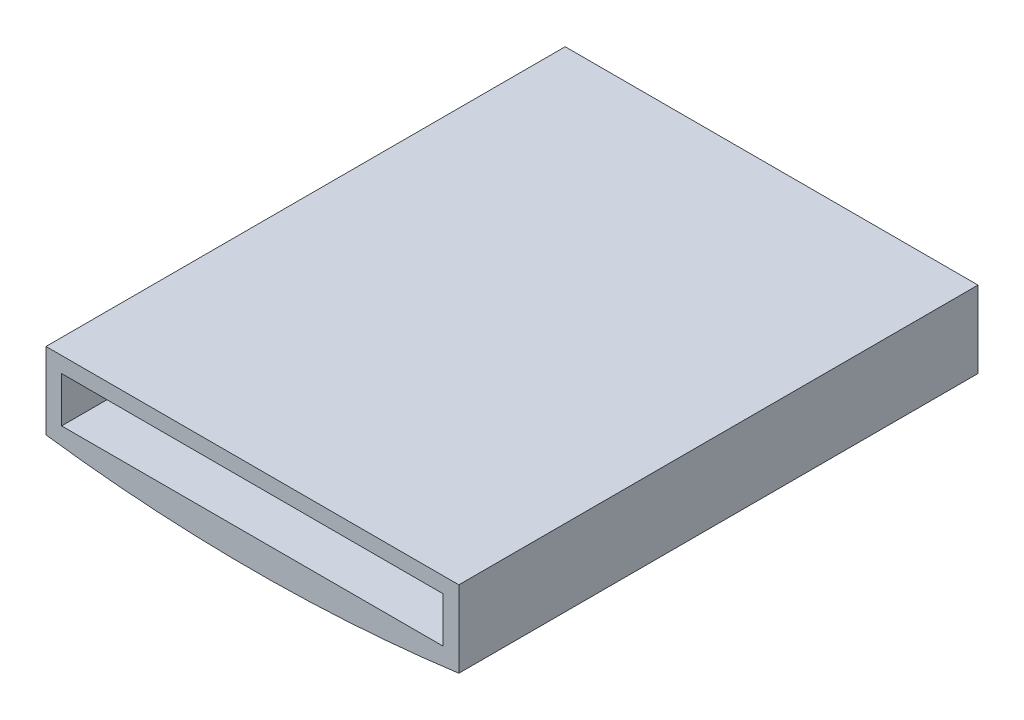
from build123d import *

# Parameters (mm, degrees)
SKETCH1_W           = 244
SKETCH1_H           = 29
BOSS_EXTRUDE1_DEPTH = 166
SKETCH3_W           = 264
SKETCH3_H           = 30.556086773
CUT_EXTRUDE2_DEPTH  = 151
SKETCH4_W           = 264
SKETCH4_H           = 302
BOSS_EXTRUDE2_DEPTH = 10


with BuildPart() as part:
    # Sketch1 → Boss-Extrude1 (new, symmetric)
    with BuildSketch(Plane.XY):
        with BuildLine():
            Line((0, 0), (0, 49))
            Line((0, 49), (264, 49))
            Line((264, 49), (264, 0))
            ThreePointArc((264, 0), (132, -8.755804433), (0, 0))
        make_face()
        with Locations((132, 24.5)):
            Rectangle(SKETCH1_W, SKETCH1_H, mode=Mode.SUBTRACT)
    extrude(amount=BOSS_EXTRUDE1_DEPTH, both=True)

    # Sketch3 → Cut-Extrude2 (cut, symmetric)
    with BuildSketch(Plane.XY):
        with Locations((132, -5.278043387)):
            Rectangle(SKETCH3_W, SKETCH3_H)
    extrude(amount=CUT_EXTRUDE2_DEPTH, both=True, mode=Mode.SUBTRACT)

    # Sketch4 → Boss-Extrude2 (add)
    with BuildSketch(Plane(origin=(0, 10, 0), x_dir=(-1, 0, 0), z_dir=(0, -1, 0))):
        with Locations((-132, 0)):
            Rectangle(SKETCH4_W, SKETCH4_H)
    extrude(amount=BOSS_EXTRUDE2_DEPTH)


solid = part.part
